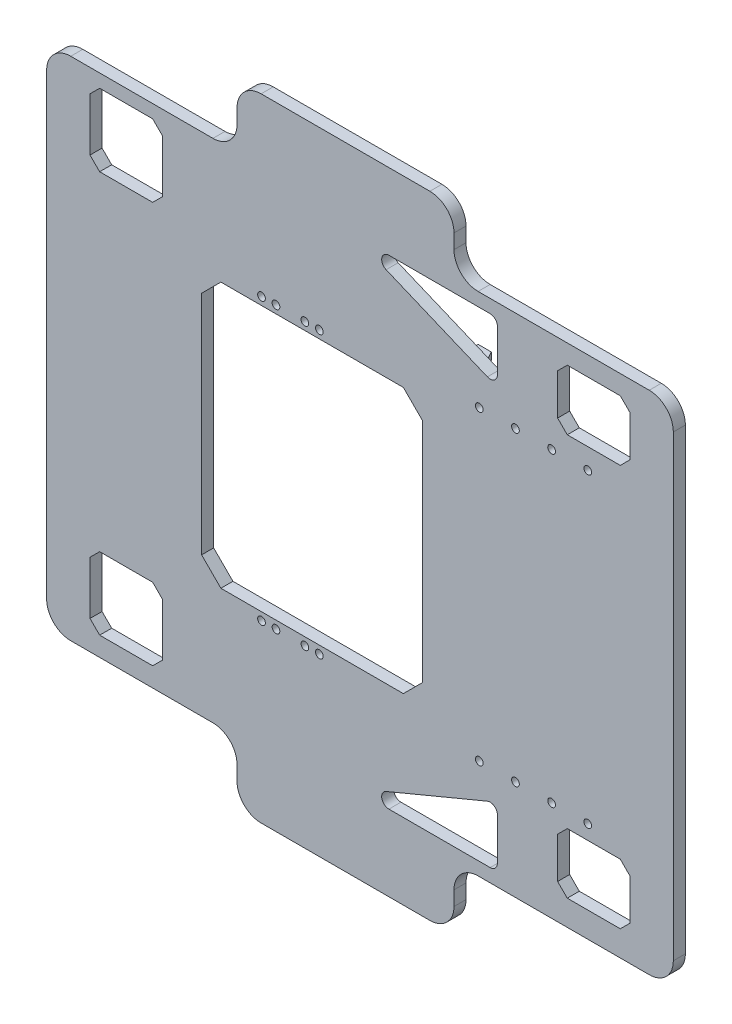
from build123d import *

# Parameters (mm, degrees)
EXTRUDE_1_DEPTH       = 5
CUT_EXTRUDE_1_DEPTH   = 185.623942109
CUT_EXTRUDE_2_DEPTH   = 185.623942109
EXTRUDE_2_DEPTH       = 15
CUT_EXTRUDE_3_DEPTH   = 10
CUT_EXTRUDE_4_DEPTH   = 10
MIRROR_2_COPY_1_DEPTH = 15
MIRROR_2_COPY_2_DEPTH = 10
MIRROR_2_COPY_3_DEPTH = 10
SKETCH_7_R            = 1.6
CUT_EXTRUDE_5_DEPTH   = 186.16479147
SKETCH_8_R            = 1.6
CUT_EXTRUDE_6_DEPTH   = 186.16479147


with BuildPart() as part:
    # 草图1 → 凸台-拉伸1 (new body)
    with BuildSketch(Plane.XY):
        with BuildLine():
            Line((-51, 115), (-51, 121))
            ThreePointArc((-51, 121), (-48.071067812, 128.071067812), (-41, 131))
            Line((-41, 131), (29, 131))
            ThreePointArc((29, 131), (36.071067812, 128.071067812), (39, 121))
            Line((39, 121), (39, 115))
            ThreePointArc((39, 115), (41.928932188, 107.928932188), (49, 105))
            Line((49, 105), (120, 105))
            ThreePointArc((120, 105), (127.071067812, 102.071067812), (130, 95))
            Line((130, 95), (130, -95))
            ThreePointArc((130, -95), (127.071067812, -102.071067812), (120, -105))
            Line((120, -105), (49, -105))
            ThreePointArc((49, -105), (41.928932188, -107.928932188), (39, -115))
            Line((39, -115), (39, -121))
            ThreePointArc((39, -121), (36.071067812, -128.071067812), (29, -131))
            Line((29, -131), (-41, -131))
            ThreePointArc((-41, -131), (-48.071067812, -128.071067812), (-51, -121))
            Line((-51, -121), (-51, -115))
            ThreePointArc((-51, -115), (-53.928932188, -107.928932188), (-61, -105))
            Line((-61, -105), (-120, -105))
            ThreePointArc((-120, -105), (-127.071067812, -102.071067812), (-130, -95))
            Line((-130, -95), (-130, 95))
            ThreePointArc((-130, 95), (-127.071067812, 102.071067812), (-120, 105))
            Line((-120, 105), (-61, 105))
            ThreePointArc((-61, 105), (-53.928932188, 107.928932188), (-51, 115))
        make_face()
    extrude(amount=EXTRUDE_1_DEPTH)

    # 草图2 → 切除-拉伸1 (cut, through all)
    with BuildSketch(Plane.XY.offset(5)):
        with BuildLine():
            Line((10.846153846, -93.730769231), (52.846153846, -76.230769231))
            ThreePointArc((52.846153846, -76.230769231), (55.664100589, -76.503849117), (57, -79))
            Line((57, -79), (57, -96.5))
            ThreePointArc((57, -96.5), (56.121320344, -98.621320344), (54, -99.5))
            Line((54, -99.5), (12, -99.5))
            ThreePointArc((12, -99.5), (9.058257973, -97.088348405), (10.846153846, -93.730769231))
        make_face()
        Polygon((-108, 99.5), (-86, 99.5), (-82, 95.5), (-82, 73.5), (-86, 69.5), (-108, 69.5), (-112, 73.5), (-112, 95.5), align=None)
        Polygon((-108, -67), (-86, -67), (-82, -71), (-82, -93), (-86, -97), (-108, -97), (-112, -93), (-112, -71), align=None)
        Polygon((86, 97), (108, 97), (112, 93), (112, 76), (108, 72), (86, 72), (82, 76), (82, 93), align=None)
        Polygon((86, -69.5), (108, -69.5), (112, -73.5), (112, -90.5), (108, -94.5), (86, -94.5), (82, -90.5), (82, -73.5), align=None)
        with BuildLine():
            Line((12, 99.5), (54, 99.5))
            ThreePointArc((54, 99.5), (56.121320344, 98.621320344), (57, 96.5))
            Line((57, 96.5), (57, 79))
            ThreePointArc((57, 79), (55.664100589, 76.503849117), (52.846153846, 76.230769231))
            Line((52.846153846, 76.230769231), (10.846153846, 93.730769231))
            ThreePointArc((10.846153846, 93.730769231), (9.058257973, 97.088348405), (12, 99.5))
        make_face()
    extrude(amount=-CUT_EXTRUDE_1_DEPTH, mode=Mode.SUBTRACT)

    # 草图3 → 切除-拉伸2 (cut, through all)
    with BuildSketch(Plane(origin=(0, 0, 0), x_dir=(-1, 0, 0), z_dir=(0, 0, -1))):
        Polygon((57.7, 55), (-18, 55), (-26, 47), (-26, -47), (-18, -55), (57.7, -55), (65.7, -47), (65.7, 47), align=None)
    extrude(amount=-CUT_EXTRUDE_2_DEPTH, mode=Mode.SUBTRACT)

    # 草图4 → 凸台-拉伸2 (add)
    with BuildSketch(Plane(origin=(0, 0, 0), x_dir=(-1, 0, 0), z_dir=(0, 0, -1))):
        Polygon((-29, -55), (-29, -66), (-40, -66), (-40, -63), (-32, -63), (-32, -55), align=None)
    extrude_2 = extrude(amount=EXTRUDE_2_DEPTH)

    # 草图5 → 切除-拉伸3 (cut)
    with BuildSketch(Plane.XZ.offset(66)):
        Polygon((40, -5), (34.5, -15), (40, -15), align=None)
    cut_extrude_3 = extrude(amount=-CUT_EXTRUDE_3_DEPTH, mode=Mode.SUBTRACT)

    # 草图6 → 切除-拉伸4 (cut)
    with BuildSketch(Plane.ZY.offset(-29)):
        Polygon((-15, -60.5), (-5, -55), (-15, -55), align=None)
    cut_extrude_4 = extrude(amount=-CUT_EXTRUDE_4_DEPTH, mode=Mode.SUBTRACT)

    # 镜向1: 凸台-拉伸2, 切除-拉伸3, 切除-拉伸4 across plane
    add(extrude_2.mirror(Plane.ZY.offset(-72)))
    add(cut_extrude_3.mirror(Plane.ZY.offset(-72)), mode=Mode.SUBTRACT)
    add(cut_extrude_4.mirror(Plane.ZY.offset(-72)), mode=Mode.SUBTRACT)

    # 镜向2: 凸台-拉伸2, 切除-拉伸3, 切除-拉伸4 across plane
    add(extrude_2.mirror(Plane.ZX))
    add(cut_extrude_3.mirror(Plane.ZX), mode=Mode.SUBTRACT)
    add(cut_extrude_4.mirror(Plane.ZX), mode=Mode.SUBTRACT)

    # 镜向2 copy 1 sketch → 镜向2 copy 1 (add)
    with BuildSketch(Plane(origin=(144, 0, 0), x_dir=(1, 0, 0), z_dir=(0, 0, -1))):
        Polygon((-29, -55), (-29, -66), (-40, -66), (-40, -63), (-32, -63), (-32, -55), align=None)
    extrude(amount=MIRROR_2_COPY_1_DEPTH)

    # 镜向2 copy 2 sketch → 镜向2 copy 2 (cut)
    with BuildSketch(Plane(origin=(144, 66, 0), x_dir=(-1, 0, 0), z_dir=(0, 1, 0))):
        Polygon((40, -5), (34.5, -15), (40, -15), align=None)
    extrude(amount=-MIRROR_2_COPY_2_DEPTH, mode=Mode.SUBTRACT)

    # 镜向2 copy 3 sketch → 镜向2 copy 3 (cut)
    with BuildSketch(Plane(origin=(115, 0, 0), x_dir=(0, 0, 1), z_dir=(1, 0, 0))):
        Polygon((-15, -60.5), (-5, -55), (-15, -55), align=None)
    extrude(amount=-MIRROR_2_COPY_3_DEPTH, mode=Mode.SUBTRACT)

    # 草图7 → 切除-拉伸5 (cut, through all)
    with BuildSketch(Plane(origin=(0, 0, 0), x_dir=(-1, 0, 0), z_dir=(0, 0, -1))):
        with Locations((16.85, -58.25)):
            Circle(SKETCH_7_R)
        with Locations((22.85, -58.25)):
            Circle(SKETCH_7_R)
        with Locations((40.85, -58.25)):
            Circle(SKETCH_7_R)
        with Locations((34.85, -58.25)):
            Circle(SKETCH_7_R)
    cut_extrude_5 = extrude(amount=-CUT_EXTRUDE_5_DEPTH, mode=Mode.SUBTRACT)

    # 镜向3: 切除-拉伸5 across plane
    add(cut_extrude_5.mirror(Plane.ZX), mode=Mode.SUBTRACT)

    # 草图8 → 切除-拉伸6 (cut, through all)
    with BuildSketch(Plane(origin=(0, 0, 0), x_dir=(-1, 0, 0), z_dir=(0, 0, -1))):
        with Locations((-49.5, -63.495385915)):
            Circle(SKETCH_8_R)
        with Locations((-64.5, -63.495385915)):
            Circle(SKETCH_8_R)
        with Locations((-79.5, -63.495385915)):
            Circle(SKETCH_8_R)
        with Locations((-94.5, -63.495385915)):
            Circle(SKETCH_8_R)
    cut_extrude_6 = extrude(amount=-CUT_EXTRUDE_6_DEPTH, mode=Mode.SUBTRACT)

    # 镜向4: 切除-拉伸6 across plane
    add(cut_extrude_6.mirror(Plane.ZX), mode=Mode.SUBTRACT)


solid = part.part
